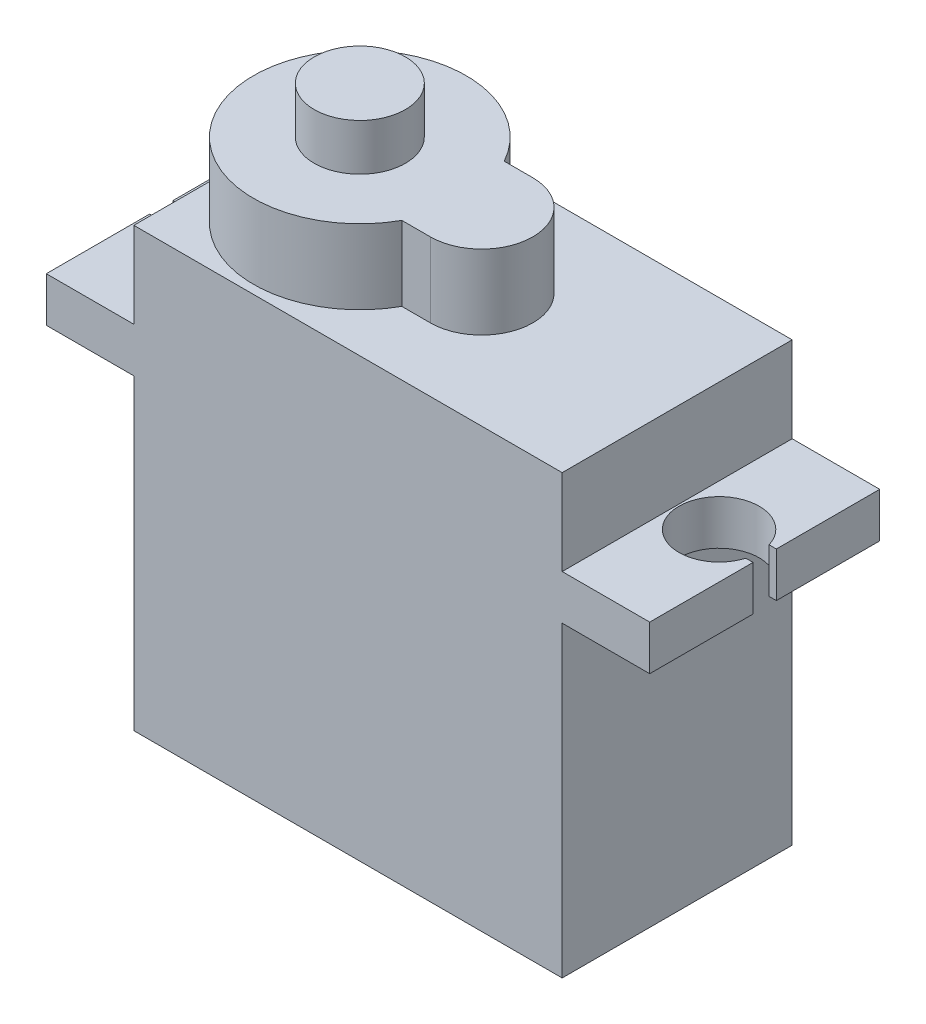
from build123d import *

# Parameters (mm, degrees)
BOSS_EXTRUDE1_DEPTH = 6.175
BOSS_EXTRUDE2_DEPTH = 4
SKETCH4_R           = 2.45
BOSS_EXTRUDE3_DEPTH = 2.5
CUT_EXTRUDE1_REACH  = 36.097


with BuildPart() as part:
    # Sketch1 → Boss-Extrude1 (new, symmetric)
    with BuildSketch(Plane.XY):
        Polygon((0, 0), (23, 0), (23, 16.5), (27.7, 16.5), (27.7, 18.9), (23, 18.9), (23, 23.5), (0, 23.5), (0, 18.9), (-4.7, 18.9), (-4.7, 16.5), (0, 16.5), align=None)
    extrude(amount=BOSS_EXTRUDE1_DEPTH, both=True)

    # Sketch3 → Boss-Extrude2 (add)
    with BuildSketch(Plane(origin=(0, 23.5, 0), x_dir=(1, 0, 0), z_dir=(0, 1, 0))):
        with BuildLine():
            Line((12.5, 2.75), (10.964158271, 2.75))
            ThreePointArc((10.964158271, 2.75), (0.25, 0), (10.964158271, -2.75))
            Line((10.964158271, -2.75), (12.5, -2.75))
            ThreePointArc((12.5, -2.75), (15.25, 0), (12.5, 2.75))
        make_face()
    extrude(amount=BOSS_EXTRUDE2_DEPTH)

    # Sketch4 → Boss-Extrude3 (add)
    with BuildSketch(Plane(origin=(0, 27.5, 0), x_dir=(1, 0, 0), z_dir=(0, 1, 0))):
        with Locations(Location((5.96, 0, 0), (0, 0, 180))):
            Circle(SKETCH4_R)
    extrude(amount=BOSS_EXTRUDE3_DEPTH)

    # Sketch5 → Cut-Extrude1 (cut, up to next)
    with BuildSketch(Plane(origin=(0, 18.9, 0), x_dir=(1, 0, 0), z_dir=(0, 1, 0)), mode=Mode.PRIVATE) as cut_extrude1_sk1:
        with BuildLine():
            Line((-4.7, 0.625), (-4.311332336, 0.625))
            ThreePointArc((-4.311332336, 0.625), (-0.096, 0), (-4.311332336, -0.625))
            Line((-4.311332336, -0.625), (-4.7, -0.625))
            Line((-4.7, -0.625), (-4.7, 0.625))
        make_face()
    cut_extrude1_tool1 = extrude(cut_extrude1_sk1.sketch, amount=-CUT_EXTRUDE1_REACH, mode=Mode.PRIVATE) & part.part
    # Sketch5 → Cut-Extrude1 (cut, up to next)
    with BuildSketch(Plane(origin=(0, 18.9, 0), x_dir=(1, 0, 0), z_dir=(0, 1, 0)), mode=Mode.PRIVATE) as cut_extrude1_sk2:
        with BuildLine():
            Line((27.311332336, 0.625), (27.7, 0.625))
            Line((27.7, 0.625), (27.7, -0.625))
            Line((27.7, -0.625), (27.311332336, -0.625))
            ThreePointArc((27.311332336, -0.625), (23.096, 0), (27.311332336, 0.625))
        make_face()
    cut_extrude1_tool2 = extrude(cut_extrude1_sk2.sketch, amount=-CUT_EXTRUDE1_REACH, mode=Mode.PRIVATE) & part.part
    add(cut_extrude1_tool1.solids().sort_by_distance((-2.312273, 18.9, 0))[0], mode=Mode.SUBTRACT)
    add(cut_extrude1_tool2.solids().sort_by_distance((25.312273, 18.9, 0))[0], mode=Mode.SUBTRACT)


solid = part.part
